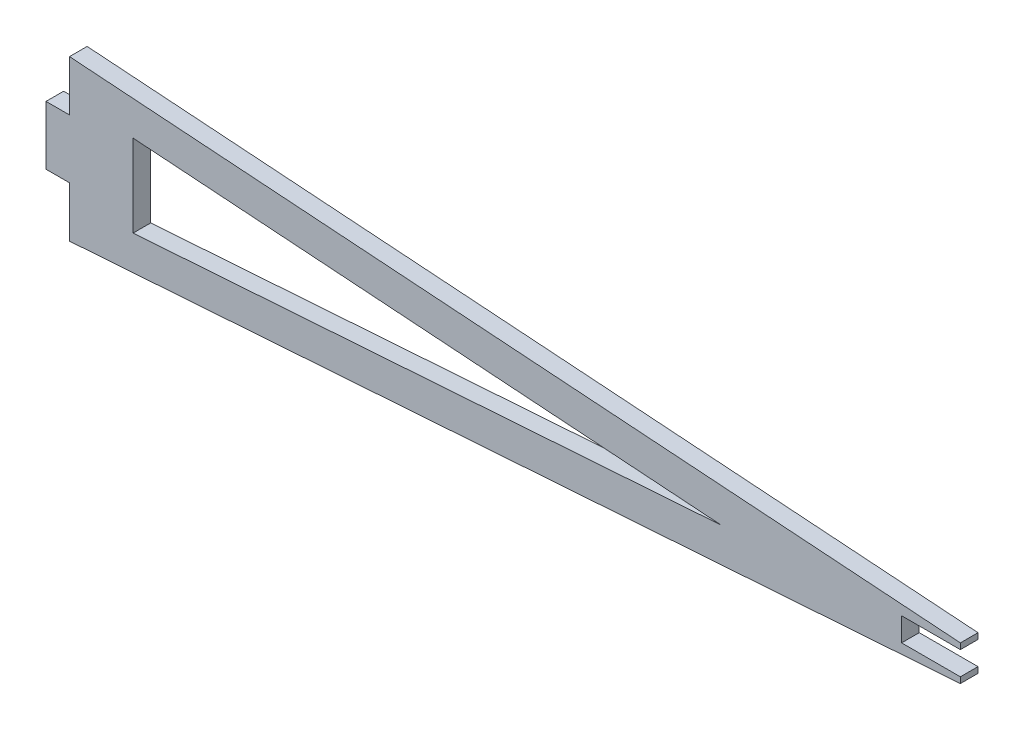
from build123d import *

# Parameters (mm, degrees)
EXTRUDE_1_DEPTH = 15


with BuildPart() as part:
    # Model → 凸台-拉伸1 (new body)
    with BuildSketch(Plane.XY):
        Polygon((184.411857588, 120.010493647), (204.418760095, 120.010493647), (204.418760095, 77.010493647), (962.354071701, 130.010493647), (962.354071701, 135.010493647), (912.354071701, 135.010493647), (912.354071701, 155.010493647), (962.354067739, 155.010493647), (962.354063778, 160.010493647), (204.418760095, 213.010493093), (204.411857588, 170.010493647), (184.411857588, 170.010493647), align=None)
        Polygon((258.506130737, 110.010493647), (258.506130737, 180.010493647), (759.029449722, 145.010493647), align=None, mode=Mode.SUBTRACT)
    extrude(amount=EXTRUDE_1_DEPTH)


solid = part.part
